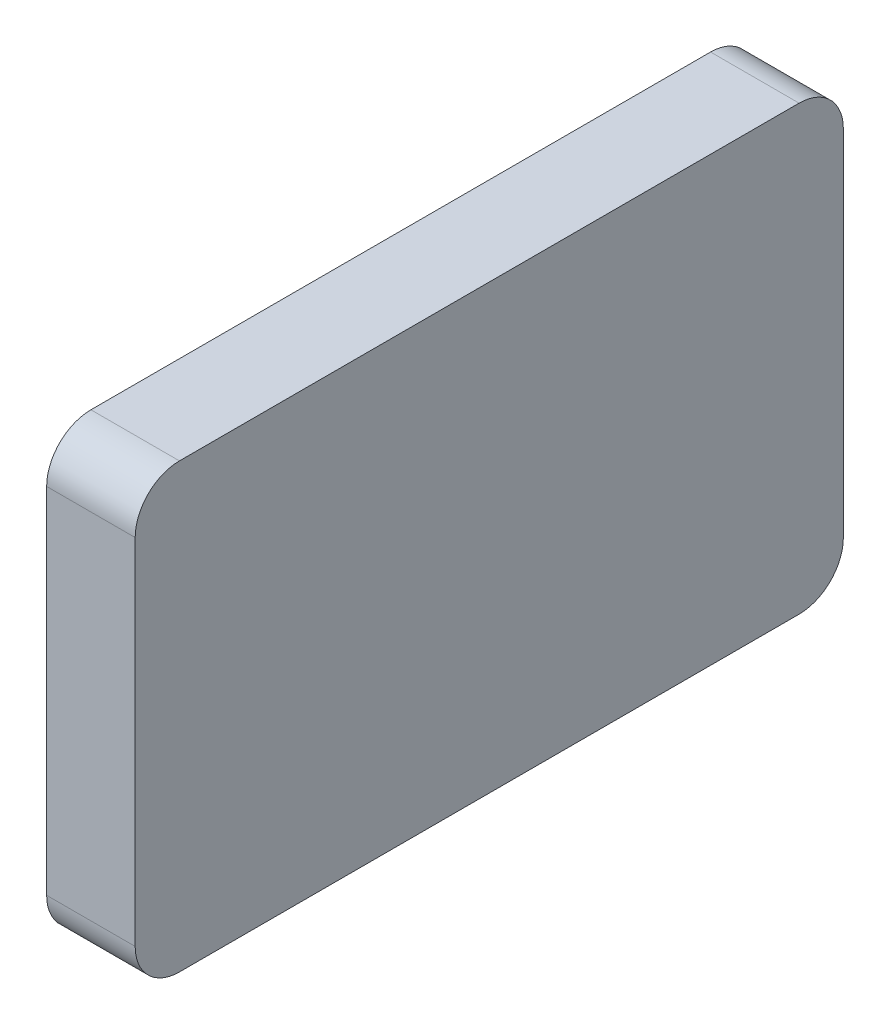
from build123d import *

# Parameters (mm, degrees)
BASES_W    = 8
BASES_H    = 5
BASE_DEPTH = 0.5
BASEF_R    = 0.5


with BuildPart() as part:
    # BaseS → Base (new, symmetric)
    with BuildSketch(Plane(origin=(0, 0, 0), x_dir=(0, 0, -1), z_dir=(1, 0, 0))):
        Rectangle(BASES_W, BASES_H)
    extrude(amount=BASE_DEPTH, both=True)

    # BaseF
    basef_edges = [part.edges().sort_by_distance(p)[0] for p in [
        (0, -2.5, -4),
        (0, -2.5, 4),
        (0, 2.5, 4),
        (0, 2.5, -4),
    ]]
    fillet(basef_edges, radius=BASEF_R)


solid = part.part
